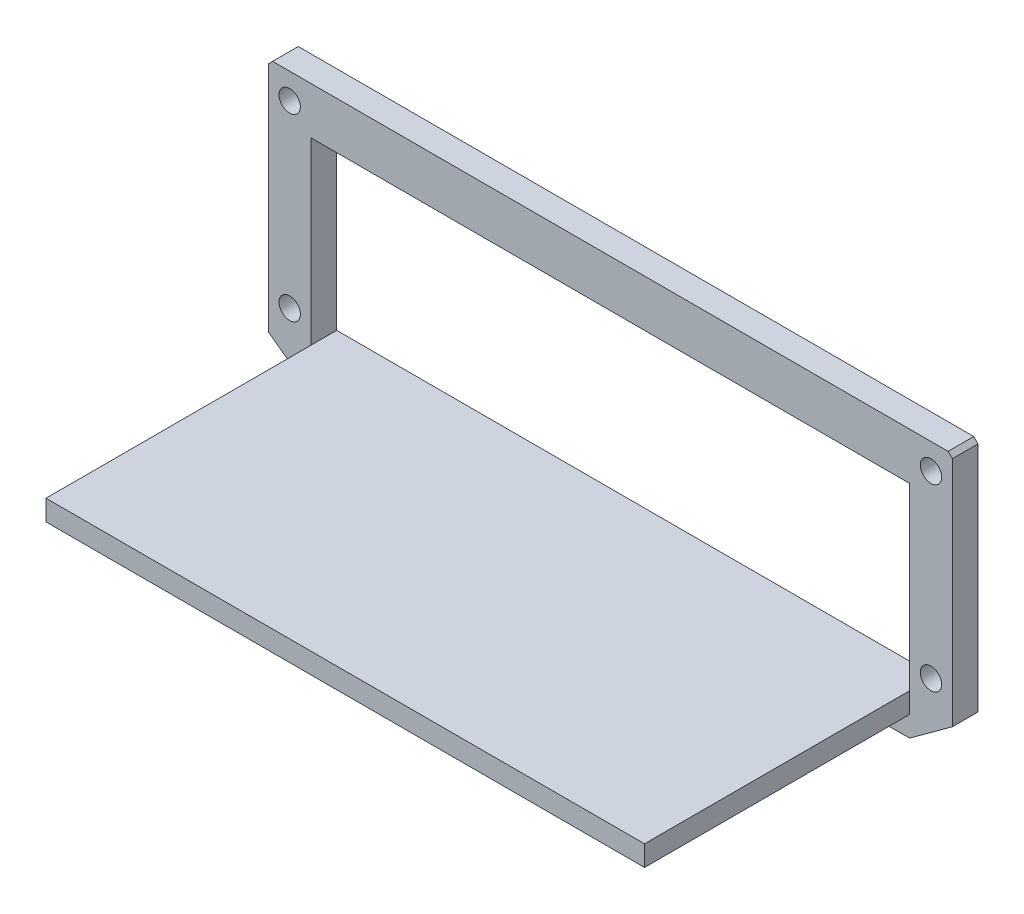
from build123d import *

# Parameters (mm, degrees)
SKETCH_1_W              = 80
SKETCH_1_H              = 34
EXTRUDE_1_DEPTH         = 3
SKETCH_2_W              = 70
SKETCH_2_H              = 23
CUT_EXTRUDE_2_DEPTH     = 3
CHAMFER_1_SIZE          = 0.5
SKETCH_7_W              = 25
SKETCH_7_H              = 3
CUT_EXTRUDE_6_DEPTH     = 3
FILLET_2_R              = 2
CHAMFER_2_SIZE          = 11
CHAMFER_2_SIZE2         = 6.350852961
CHAMFER_3_SIZE          = 11
CHAMFER_3_SIZE2         = 6.350852961
FILLET_3_R              = 2
HOLE_WIZARD_2_5_2_5_1_D = 2.5
SKETCH_11_W             = 69
SKETCH_11_H             = 10.181057749
CUT_EXTRUDE_1_DEPTH     = 10
EXTRUDE_2_DEPTH         = 3
EXTRUDE_4_DEPTH         = 3
EXTRUDE_5_DEPTH         = 31


with BuildPart() as part:
    # 草图1 → Extrude 1 (new body)
    with BuildSketch(Plane.XY):
        Rectangle(SKETCH_1_W, SKETCH_1_H)
    extrude(amount=EXTRUDE_1_DEPTH)

    # 草图2 → 拉伸2 (cut)
    with BuildSketch(Plane.XY.offset(3)):
        Rectangle(SKETCH_2_W, SKETCH_2_H)
    extrude(amount=-CUT_EXTRUDE_2_DEPTH, mode=Mode.SUBTRACT)

    # 倒角1
    chamfer_1_edges = [part.edges().sort_by_distance(p)[0] for p in [
        (-40, 17, 1.5),
        (40, 17, 1.5),
    ]]
    chamfer(chamfer_1_edges, length=CHAMFER_1_SIZE)

    # 草图7 → 拉伸6 (cut)
    with BuildSketch(Plane.XY.offset(3)):
        with Locations((0, -15.5)):
            Rectangle(SKETCH_7_W, SKETCH_7_H)
    extrude(amount=-CUT_EXTRUDE_6_DEPTH, mode=Mode.SUBTRACT)

    # 圆角2
    fillet_2_edges = [part.edges().sort_by_distance(p)[0] for p in [
        (-12.5, -14, 1.5),
        (12.5, -14, 1.5),
    ]]
    fillet(fillet_2_edges, radius=FILLET_2_R)

    # 倒角2
    chamfer_2_edges = [part.edges().sort_by_distance(p)[0] for p in [
        (40, -17, 1.5),
    ]]
    chamfer_2_side = [part.faces().sort_by_distance(p)[0] for p in [
        (26.25, -17, 1.5),
    ]]
    chamfer(chamfer_2_edges, length=CHAMFER_2_SIZE, length2=CHAMFER_2_SIZE2, reference=chamfer_2_side[0])

    # 倒角3
    chamfer_3_edges = [part.edges().sort_by_distance(p)[0] for p in [
        (-40, -17, 1.5),
    ]]
    chamfer_3_side = [part.faces().sort_by_distance(p)[0] for p in [
        (-26.25, -17, 1.5),
    ]]
    chamfer(chamfer_3_edges, length=CHAMFER_3_SIZE, length2=CHAMFER_3_SIZE2, reference=chamfer_3_side[0])

    # 圆角3
    fillet_3_edges = [part.edges().sort_by_distance(p)[0] for p in [
        (12.5, -17, 1.5),
        (-12.5, -17, 1.5),
    ]]
    fillet(fillet_3_edges, radius=FILLET_3_R)

    # Ø2.5 (2.5) 直径孔1 (through all)
    with Locations(Plane(origin=(-37.5, -7, 0), x_dir=(-1, 0, 0), z_dir=(0, 0, -1))):
        with Locations((0, 0), (0, 21), (-75, 21), (-75, 0)):
            Hole(HOLE_WIZARD_2_5_2_5_1_D / 2)

    # 草图11 → 切除-拉伸1 (cut)
    with BuildSketch(Plane.XY.offset(3)):
        with Locations((0, -18.915102393)):
            Rectangle(SKETCH_11_W, SKETCH_11_H)
    extrude(amount=-CUT_EXTRUDE_1_DEPTH, mode=Mode.SUBTRACT)

    # 草图12 → 凸台-拉伸2 (add)
    with BuildSketch(Plane.XY.offset(3)):
        Polygon((-40, -10.649147039), (-34.5, -13.824573519), (34.5, -13.824573519), (40, -10.649147039), (35, -14.3), (-35, -14.3), align=None)
    extrude(amount=-EXTRUDE_2_DEPTH)

    # 草图13 → 凸台-拉伸4 (add)
    with BuildSketch(Plane.XY.offset(3)):
        Polygon((-35, -11.5), (-35, -9.5), (35, -9.5), (35, -11.9), (-35, -11.9), align=None)
    extrude(amount=-EXTRUDE_4_DEPTH)

    # 草图13<2> → 凸台-拉伸5 (add)
    with BuildSketch(Plane.XY.offset(3)):
        Polygon((-35, -11.5), (-35, -9.5), (35, -9.5), (35, -11.9), (-35, -11.9), align=None)
    extrude(amount=EXTRUDE_5_DEPTH)


solid = part.part
